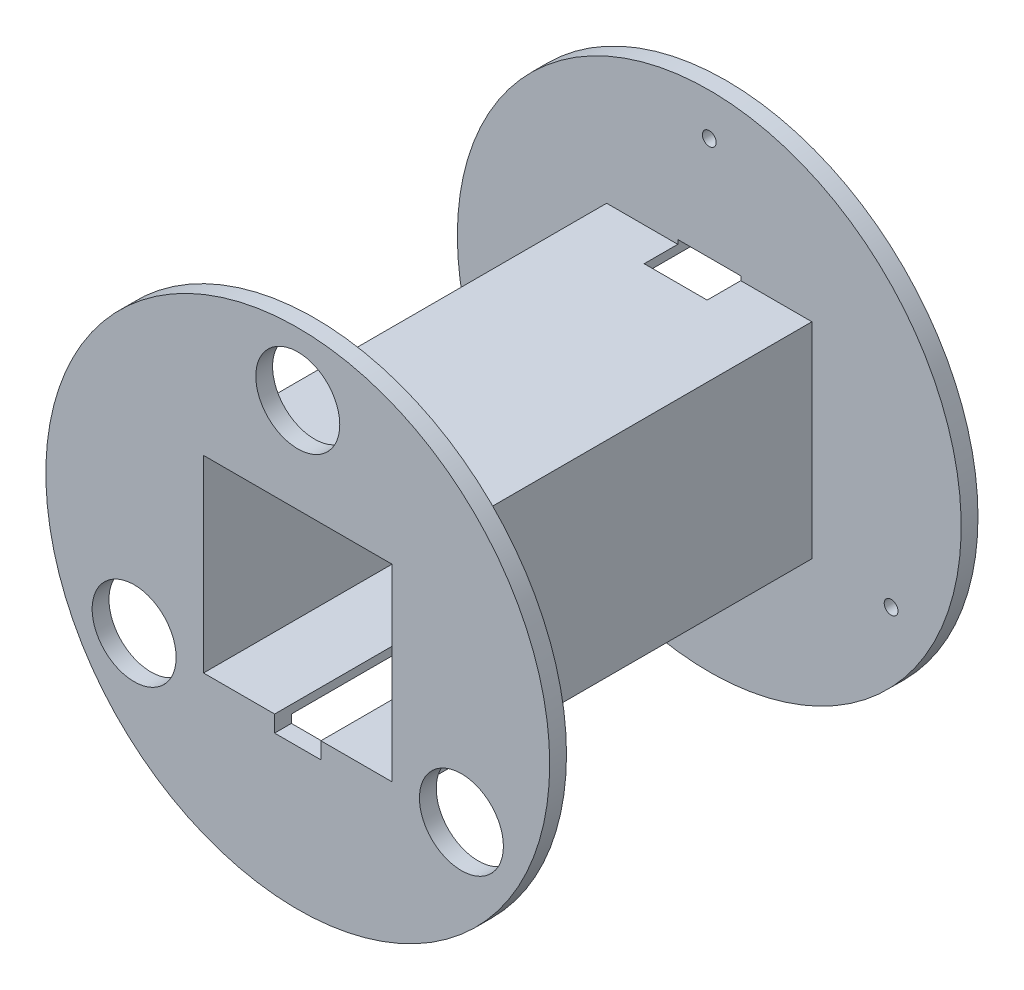
from build123d import *

# Parameters (mm, degrees)
SKETCH1_R           = 76.2
BOSS_EXTRUDE1_DEPTH = 129.54
CUT_EXTRUDE1_START  = -5.08
SKETCH2_R           = 76.2
SKETCH2_W           = 62.08
SKETCH2_H           = 62.08
CUT_EXTRUDE1_DEPTH  = 119.38
SKETCH3_W           = 57
SKETCH3_H           = 57
CUT_EXTRUDE2_DEPTH  = 129.54
SKETCH4_R           = 2.0828
CUT_EXTRUDE3_DEPTH  = 5.08
SKETCH5_R           = 12.7
CUT_EXTRUDE4_DEPTH  = 5.08
SKETCH8_W           = 14
SKETCH8_H           = 5
CUT_EXTRUDE5_DEPTH  = 169.503684233
SKETCH9_W           = 19.05
SKETCH9_H           = 7.62
CUT_EXTRUDE6_DEPTH  = 15.24


with BuildPart() as part:
    # Sketch1 → Boss-Extrude1 (new body)
    with BuildSketch(Plane.XY):
        Circle(SKETCH1_R)
    extrude(amount=BOSS_EXTRUDE1_DEPTH)

    # Sketch2 → Cut-Extrude1 (cut)
    with BuildSketch(Plane(origin=(0, 0, 0), x_dir=(-1, 0, 0), z_dir=(0, 0, -1)).offset(CUT_EXTRUDE1_START)):
        Circle(SKETCH2_R)
        Rectangle(SKETCH2_W, SKETCH2_H, mode=Mode.SUBTRACT)
    extrude(amount=-CUT_EXTRUDE1_DEPTH, mode=Mode.SUBTRACT)

    # Sketch3 → Cut-Extrude2 (cut)
    with BuildSketch(Plane(origin=(0, 0, 0), x_dir=(-1, 0, 0), z_dir=(0, 0, -1))):
        Rectangle(SKETCH3_W, SKETCH3_H)
    extrude(amount=-CUT_EXTRUDE2_DEPTH, mode=Mode.SUBTRACT)

    # Sketch4 → Cut-Extrude3 (cut)
    with BuildSketch(Plane(origin=(0, 0, 0), x_dir=(-1, 0, 0), z_dir=(0, 0, -1))):
        with Locations((0, 63.5)):
            Circle(SKETCH4_R)
        with Locations((54.99261314, -31.75)):
            Circle(SKETCH4_R)
        with Locations((-54.99261314, -31.75)):
            Circle(SKETCH4_R)
    extrude(amount=-CUT_EXTRUDE3_DEPTH, mode=Mode.SUBTRACT)

    # Sketch5 → Cut-Extrude4 (cut)
    with BuildSketch(Plane.XY.offset(129.54)):
        with Locations((0, 57.15)):
            Circle(SKETCH5_R)
        with Locations((49.493351826, -28.575)):
            Circle(SKETCH5_R)
        with Locations((-49.493351826, -28.575)):
            Circle(SKETCH5_R)
    extrude(amount=-CUT_EXTRUDE4_DEPTH, mode=Mode.SUBTRACT)

    # Sketch8 → Cut-Extrude5 (cut, through all)
    with BuildSketch(Plane.XY.offset(129.54)):
        with Locations((0, -31)):
            Rectangle(SKETCH8_W, SKETCH8_H)
    extrude(amount=-CUT_EXTRUDE5_DEPTH, mode=Mode.SUBTRACT)

    # Sketch9 → Cut-Extrude6 (cut)
    with BuildSketch(Plane(origin=(0, 0, 0), x_dir=(-1, 0, 0), z_dir=(0, 0, -1))):
        with Locations((0, 28.5)):
            Rectangle(SKETCH9_W, SKETCH9_H)
    extrude(amount=-CUT_EXTRUDE6_DEPTH, mode=Mode.SUBTRACT)


solid = part.part
